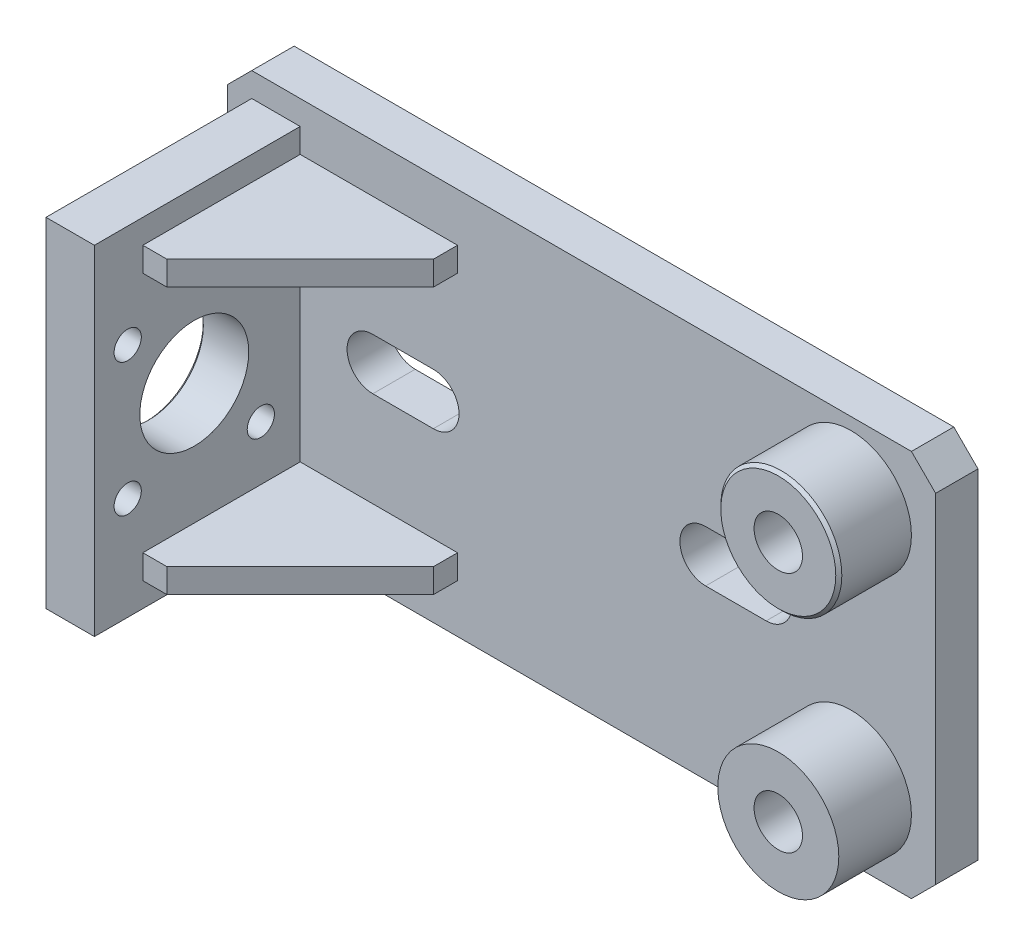
from build123d import *

# Parameters (mm, degrees)
ESQUISSE1_W             = 117
ESQUISSE1_H             = 64
BASE_EXTRUSION_DEPTH    = 7
CHANFREIN1_SIZE         = 4
ESQUISSE2_R             = 10
BOSS_EXTRU_1_DEPTH      = 12
CHANFREIN3_SIZE         = 0.5
ESQUISSE5_R             = 10
BOSS_EXTRU_4_DEPTH      = 12
ESQUISSE7_W             = 8
ESQUISSE7_H             = 56
BOSS_EXTRU_7_DEPTH      = 34
ESQUISSE10_W            = 26
ESQUISSE10_H            = 4
BOSS_EXTRU_9_DEPTH      = 26
CHANFREIN6_SIZE         = 22
ESQUISSE12_W            = 26
ESQUISSE12_H            = 4
BOSS_EXTRU_11_DEPTH     = 26
CHANFREIN7_SIZE         = 22
ESQUISSE13_R            = 9
ENL_V_MAT_EXTRU_1_DEPTH = 118.175082675
CHANFREIN8_SIZE         = 0.5
ESQUISSE3_R             = 4
ENL_V_MAT_EXTRU_2_DEPTH = 98.103038058
ESQUISSE6_R             = 4
ENL_V_MAT_EXTRU_3_DEPTH = 115.893630598
ESQUISSE14_R            = 2.25
ENL_V_MAT_EXTRU_4_DEPTH = 10
ENL_V_MAT_EXTRU_5_DEPTH = 10


with BuildPart() as part:
    # Esquisse1 → Base-Extrusion (new body)
    with BuildSketch(Plane.XY):
        with Locations((-30.5, 0)):
            Rectangle(ESQUISSE1_W, ESQUISSE1_H)
    extrude(amount=BASE_EXTRUSION_DEPTH)

    # Chanfrein1
    chanfrein1_edges = [part.edges().sort_by_distance(p)[0] for p in [
        (-89, 32, 3.5),
        (28, 32, 3.5),
        (28, -32, 3.5),
        (-89, -32, 3.5),
    ]]
    chamfer(chanfrein1_edges, length=CHANFREIN1_SIZE)

    # Esquisse2 → Boss.-Extru.1 (add)
    with BuildSketch(Plane.XY.offset(7)):
        with Locations((14, 20)):
            Circle(ESQUISSE2_R)
    extrude(amount=BOSS_EXTRU_1_DEPTH)

    # Chanfrein3
    chanfrein3_edges = [part.edges().sort_by_distance(p)[0] for p in [
        (4, 20, 19),
    ]]
    chamfer(chanfrein3_edges, length=CHANFREIN3_SIZE)

    # Esquisse5 → Boss.-Extru.4 (add)
    with BuildSketch(Plane(origin=(2.388625814, -32.120396389, 7), x_dir=(1, 0, 0), z_dir=(0, 0, 1))):
        with Locations((11.611374186, 12.120396389)):
            Circle(ESQUISSE5_R)
    extrude(amount=BOSS_EXTRU_4_DEPTH)

    # Esquisse7 → Boss.-Extru.7 (add)
    with BuildSketch(Plane.XY.offset(7)):
        with Locations((-81, 0)):
            Rectangle(ESQUISSE7_W, ESQUISSE7_H)
    extrude(amount=BOSS_EXTRU_7_DEPTH)

    # Esquisse10 → Boss.-Extru.9 (add)
    with BuildSketch(Plane(origin=(-77, 0, 0), x_dir=(0, 0, -1), z_dir=(1, 0, 0))):
        with Locations((-20, -22)):
            Rectangle(ESQUISSE10_W, ESQUISSE10_H)
    extrude(amount=BOSS_EXTRU_9_DEPTH)

    # Chanfrein6
    chanfrein6_edges = [part.edges().sort_by_distance(p)[0] for p in [
        (-51, -22, 33),
    ]]
    chamfer(chanfrein6_edges, length=CHANFREIN6_SIZE)

    # Esquisse12 → Boss.-Extru.11 (add)
    with BuildSketch(Plane(origin=(-77, 31.797692959, 13.355678207), x_dir=(0, 0, -1), z_dir=(1, 0, 0))):
        with Locations((-6.644321793, -9.797692959)):
            Rectangle(ESQUISSE12_W, ESQUISSE12_H)
    extrude(amount=BOSS_EXTRU_11_DEPTH)

    # Chanfrein7
    chanfrein7_edges = [part.edges().sort_by_distance(p)[0] for p in [
        (-51, 22, 33),
    ]]
    chamfer(chanfrein7_edges, length=CHANFREIN7_SIZE)

    # Esquisse13 → Enlèv. mat.-Extru.1 (cut, through all)
    with BuildSketch(Plane(origin=(-77, 0, 0), x_dir=(0, 0, -1), z_dir=(1, 0, 0))):
        with Locations((-24.5, 0)):
            Circle(ESQUISSE13_R)
    extrude(amount=-ENL_V_MAT_EXTRU_1_DEPTH, mode=Mode.SUBTRACT)

    # Chanfrein8
    chanfrein8_edges = [part.edges().sort_by_distance(p)[0] for p in [
        (-85, 0, 33.5),
    ]]
    chamfer(chanfrein8_edges, length=CHANFREIN8_SIZE)

    # Esquisse3 → Enlèv. mat.-Extru.2 (cut, through all)
    with BuildSketch(Plane.XY.offset(19)):
        with Locations((14, 20)):
            Circle(ESQUISSE3_R)
    extrude(amount=-ENL_V_MAT_EXTRU_2_DEPTH, mode=Mode.SUBTRACT)

    # Esquisse6 → Enlèv. mat.-Extru.3 (cut, through all)
    with BuildSketch(Plane(origin=(6.243462417, -28.375733692, 19), x_dir=(1, 0, 0), z_dir=(0, 0, 1))):
        with Locations((7.756537583, 8.375733692)):
            Circle(ESQUISSE6_R)
    extrude(amount=-ENL_V_MAT_EXTRU_3_DEPTH, mode=Mode.SUBTRACT)

    # Esquisse14 → Enlèv. mat.-Extru.4 (cut)
    with BuildSketch(Plane.ZY.offset(85)):
        with Locations((35.5, 11)):
            Circle(ESQUISSE14_R)
        with Locations((13.5, 11)):
            Circle(ESQUISSE14_R)
        with Locations((13.5, -11)):
            Circle(ESQUISSE14_R)
        with Locations((35.5, -11)):
            Circle(ESQUISSE14_R)
    extrude(amount=-ENL_V_MAT_EXTRU_4_DEPTH, mode=Mode.SUBTRACT)

    # Esquisse15 → Enlèv. mat.-Extru.5 (cut)
    with BuildSketch(Plane.XY.offset(7)):
        with BuildLine():
            Line((-10, 4.25), (0, 4.25))
            ThreePointArc((0, 4.25), (4.25, 0), (0, -4.25))
            Line((0, -4.25), (-10, -4.25))
            ThreePointArc((-10, -4.25), (-14.25, 0), (-10, 4.25))
        make_face()
        with BuildLine():
            Line((-65, 4.25), (-55, 4.25))
            ThreePointArc((-55, 4.25), (-50.75, 0), (-55, -4.25))
            Line((-55, -4.25), (-65, -4.25))
            ThreePointArc((-65, -4.25), (-69.25, 0), (-65, 4.25))
        make_face()
    extrude(amount=-ENL_V_MAT_EXTRU_5_DEPTH, mode=Mode.SUBTRACT)


solid = part.part
